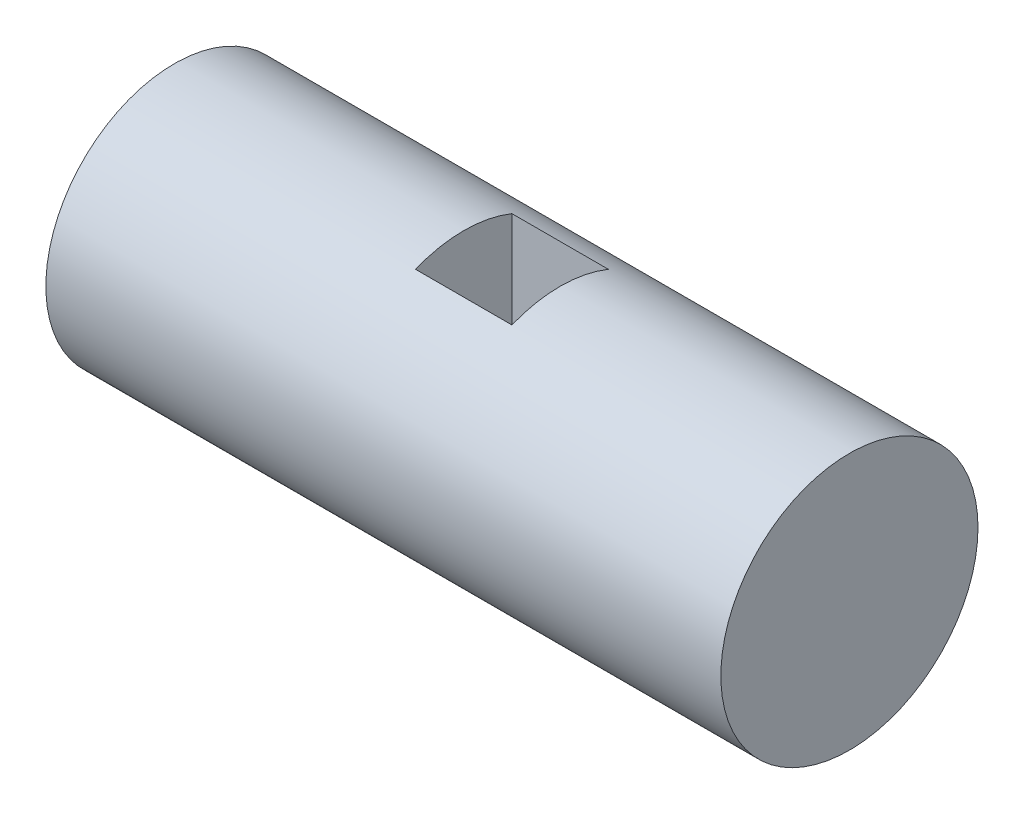
from build123d import *

# Parameters (mm, degrees)
SKETCH1_R                           = 20
BOSS_EXTRUDE1_DEPTH                 = 105
CUT_EXTRUDE1_REACH                  = 110.743
CUT_EXTRUDE1_END_RADIUS             = 20
SKETCH2_W                           = 15
SKETCH2_H                           = 15
CUT_EXTRUDE1_DIRECTION_2_REACH      = 110.743
CUT_EXTRUDE1_DIRECTION_2_END_RADIUS = 20


with BuildPart() as part:
    # Sketch1 → Boss-Extrude1 (new body)
    with BuildSketch(Plane(origin=(0, 0, 0), x_dir=(0, 0, -1), z_dir=(1, 0, 0))):
        Circle(SKETCH1_R)
    extrude(amount=BOSS_EXTRUDE1_DEPTH)

    # Cut-Extrude1: up to this cylinder (the profile starts inside it)
    cut_extrude1_end = Plane(origin=(52.5, 0, 0), z_dir=(-1, 0, 0)) * Cylinder(CUT_EXTRUDE1_END_RADIUS, 262.486, mode=Mode.PRIVATE)
    # Sketch2 → Cut-Extrude1 (cut, up to the surface)
    with BuildSketch(Plane(origin=(0, 0, 0), x_dir=(1, 0, 0), z_dir=(0, 1, 0)), mode=Mode.PRIVATE) as cut_extrude1_sk1:
        with Locations((52.5, 0)):
            Rectangle(SKETCH2_W, SKETCH2_H)
    cut_extrude1_tool1 = extrude(cut_extrude1_sk1.sketch, amount=-CUT_EXTRUDE1_REACH, mode=Mode.PRIVATE) & cut_extrude1_end
    add(cut_extrude1_tool1.solids().sort_by_distance((52.5, 0, 0))[0], mode=Mode.SUBTRACT)

    # Cut-Extrude1 direction 2: up to this cylinder (the profile starts inside it)
    cut_extrude1_direction_2_end = Plane(origin=(52.5, 0, 0), z_dir=(-1, 0, 0)) * Cylinder(CUT_EXTRUDE1_DIRECTION_2_END_RADIUS, 262.486, mode=Mode.PRIVATE)
    # Sketch2 → Cut-Extrude1 direction 2 (cut, up to the surface)
    with BuildSketch(Plane(origin=(0, 0, 0), x_dir=(1, 0, 0), z_dir=(0, 1, 0)), mode=Mode.PRIVATE) as cut_extrude1_direction_2_sk1:
        with Locations((52.5, 0)):
            Rectangle(SKETCH2_W, SKETCH2_H)
    cut_extrude1_direction_2_tool1 = extrude(cut_extrude1_direction_2_sk1.sketch, amount=CUT_EXTRUDE1_DIRECTION_2_REACH, mode=Mode.PRIVATE) & cut_extrude1_direction_2_end
    add(cut_extrude1_direction_2_tool1.solids().sort_by_distance((52.5, 0, 0))[0], mode=Mode.SUBTRACT)


solid = part.part
